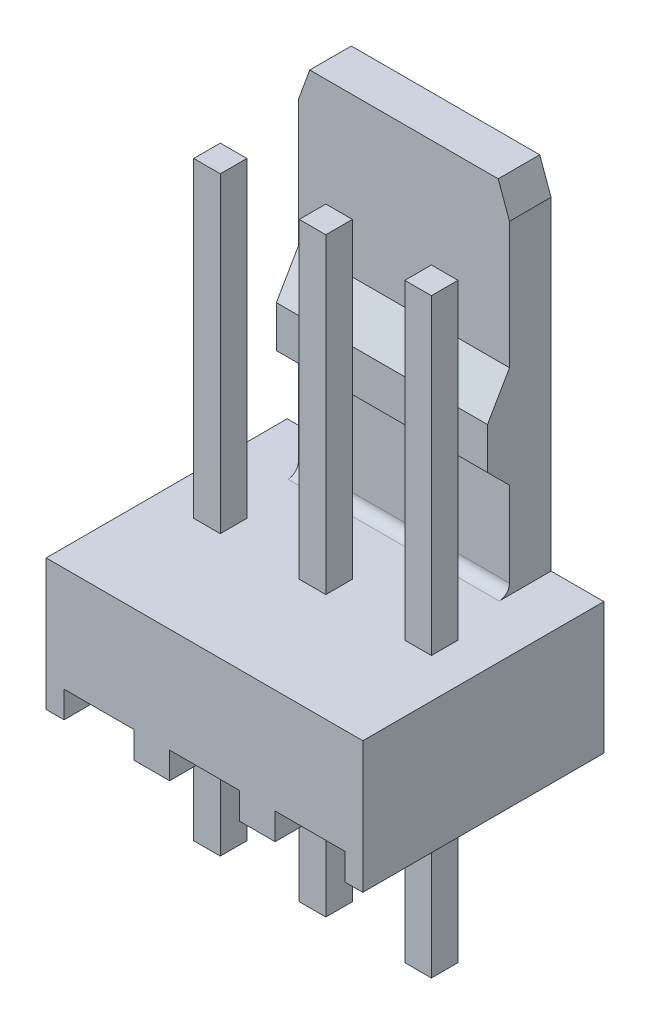
from build123d import *

# Parameters (mm, degrees)
SKETCH1_W           = 7.62
SKETCH1_H           = 5.8
BOSS_EXTRUDE1_DEPTH = 3.16
SKETCH2_W           = 5.08
SKETCH2_H           = 1
BOSS_EXTRUDE2_DEPTH = 8.54
SKETCH3_W           = 5.08
SKETCH3_H           = 6.25
BOSS_EXTRUDE3_DEPTH = 0.53
SKETCH4_W           = 1.68
SKETCH4_H           = 0.64
CUT_EXTRUDE1_DEPTH  = 13.270717175
SKETCH5_W           = 1.68
SKETCH5_H           = 0.64
CUT_EXTRUDE2_DEPTH  = 13.270717175
SKETCH6_W           = 0.53
SKETCH6_H           = 3.802013072
CUT_EXTRUDE3_DEPTH  = 13.298914586
SKETCH7_W           = 1.68
SKETCH7_H           = 0.64
CUT_EXTRUDE4_DEPTH  = 13.270717175
SKETCH8_W           = 0.64
SKETCH8_H           = 0.64
BOSS_EXTRUDE4_DEPTH = 4.2
SKETCH9_W           = 0.64
SKETCH9_H           = 0.64
BOSS_EXTRUDE5_DEPTH = 4.2
SKETCH10_W          = 0.64
SKETCH10_H          = 0.635
BOSS_EXTRUDE6_DEPTH = 4.2
SKETCH11_W          = 0.64
SKETCH11_H          = 0.64
BOSS_EXTRUDE7_DEPTH = 7.5
SKETCH12_W          = 0.64
SKETCH12_H          = 0.64
BOSS_EXTRUDE8_DEPTH = 7.5
SKETCH13_W          = 0.64
SKETCH13_H          = 0.64
BOSS_EXTRUDE9_DEPTH = 7.5
DRAFT1_ANGLE        = 45
DRAFT2_ANGLE        = 60
CHAMFER1_SIZE       = 0.75
CHAMFER1_SIZE2      = 0.272977676
CHAMFER2_SIZE       = 0.272977676
CHAMFER2_SIZE2      = 0.75
FILLET1_R           = 0.25


with BuildPart() as part:
    # Sketch1 → Boss-Extrude1 (new body)
    with BuildSketch(Plane.XZ.offset(1.58)):
        with Locations((0, 0.02)):
            Rectangle(SKETCH1_W, SKETCH1_H)
    extrude(amount=-BOSS_EXTRUDE1_DEPTH)

    # Sketch2 → Boss-Extrude2 (add)
    with BuildSketch(Plane(origin=(0, 1.58, 0), x_dir=(-1, 0, 0), z_dir=(0, 1, 0))):
        with Locations((0, -2.38)):
            Rectangle(SKETCH2_W, SKETCH2_H)
    extrude(amount=BOSS_EXTRUDE2_DEPTH)

    # Sketch3 → Boss-Extrude3 (add)
    with BuildSketch(Plane.XY.offset(-1.88)):
        with Locations((0, 6.995)):
            Rectangle(SKETCH3_W, SKETCH3_H)
    extrude(amount=BOSS_EXTRUDE3_DEPTH)

    # Sketch4 → Cut-Extrude1 (cut, through all)
    with BuildSketch(Plane(origin=(0, 0, -2.88), x_dir=(-1, 0, 0), z_dir=(0, 0, -1))):
        with Locations((2.54, -1.26)):
            Rectangle(SKETCH4_W, SKETCH4_H)
    extrude(amount=-CUT_EXTRUDE1_DEPTH, mode=Mode.SUBTRACT)

    # Sketch5 → Cut-Extrude2 (cut, through all)
    with BuildSketch(Plane(origin=(0, 0, -2.88), x_dir=(-1, 0, 0), z_dir=(0, 0, -1))):
        with Locations((0, -1.26)):
            Rectangle(SKETCH5_W, SKETCH5_H)
    extrude(amount=-CUT_EXTRUDE2_DEPTH, mode=Mode.SUBTRACT)

    # Sketch6 → Cut-Extrude3 (cut, through all)
    with BuildSketch(Plane(origin=(2.54, 0, 0), x_dir=(0, 0, -1), z_dir=(1, 0, 0))):
        with Locations((1.615, 8.218993464)):
            Rectangle(SKETCH6_W, SKETCH6_H)
    extrude(amount=-CUT_EXTRUDE3_DEPTH, mode=Mode.SUBTRACT)

    # Sketch7 → Cut-Extrude4 (cut, through all)
    with BuildSketch(Plane(origin=(0, 0, -2.88), x_dir=(-1, 0, 0), z_dir=(0, 0, -1))):
        with Locations((-2.54, -1.26)):
            Rectangle(SKETCH7_W, SKETCH7_H)
    extrude(amount=-CUT_EXTRUDE4_DEPTH, mode=Mode.SUBTRACT)

    # Sketch8 → Boss-Extrude4 (add)
    with BuildSketch(Plane.XZ.offset(0.94)):
        Rectangle(SKETCH8_W, SKETCH8_H)
    extrude(amount=BOSS_EXTRUDE4_DEPTH)

    # Sketch9 → Boss-Extrude5 (add)
    with BuildSketch(Plane.XZ.offset(0.94)):
        with Locations((-2.54, 0)):
            Rectangle(SKETCH9_W, SKETCH9_H)
    extrude(amount=BOSS_EXTRUDE5_DEPTH)

    # Sketch10 → Boss-Extrude6 (add)
    with BuildSketch(Plane.XZ.offset(0.94)):
        with Locations((2.54, 0.0025)):
            Rectangle(SKETCH10_W, SKETCH10_H)
    extrude(amount=BOSS_EXTRUDE6_DEPTH)

    # Sketch11 → Boss-Extrude7 (add)
    with BuildSketch(Plane(origin=(0, 1.58, 0), x_dir=(-1, 0, 0), z_dir=(0, 1, 0))):
        Rectangle(SKETCH11_W, SKETCH11_H)
    extrude(amount=BOSS_EXTRUDE7_DEPTH)

    # Sketch12 → Boss-Extrude8 (add)
    with BuildSketch(Plane(origin=(0, 1.58, 0), x_dir=(-1, 0, 0), z_dir=(0, 1, 0))):
        with Locations((-2.54, 0)):
            Rectangle(SKETCH12_W, SKETCH12_H)
    extrude(amount=BOSS_EXTRUDE8_DEPTH)

    # Sketch13 → Boss-Extrude9 (add)
    with BuildSketch(Plane(origin=(0, 1.58, 0), x_dir=(-1, 0, 0), z_dir=(0, 1, 0))):
        with Locations((2.54, 0)):
            Rectangle(SKETCH13_W, SKETCH13_H)
    extrude(amount=BOSS_EXTRUDE9_DEPTH)

    # Draft1
    draft1_faces = [part.faces().sort_by_distance(p)[0] for p in [
        (0, 3.87, -1.615),
    ]]
    draft(draft1_faces, Plane(origin=(2.54, 10.12, -1.88), x_dir=(1, 0, 0), z_dir=(0, 0, 1)), DRAFT1_ANGLE)

    # Draft2
    draft2_faces = [part.faces().sort_by_distance(p)[0] for p in [
        (0, 6.317986928, -1.615),
    ]]
    draft(draft2_faces, Plane(origin=(-3.810025, 6.317986928, -1.88), x_dir=(1, 0, 0), z_dir=(0, 0, 1)), DRAFT2_ANGLE)

    # Chamfer1
    chamfer1_edges = [part.edges().sort_by_distance(p)[0] for p in [
        (2.54, 10.12, -2.38),
    ]]
    chamfer1_side = [part.faces().sort_by_distance(p)[0] for p in [
        (2.54, 5.768868228, -2.309646908),
    ]]
    chamfer(chamfer1_edges, length=CHAMFER1_SIZE, length2=CHAMFER1_SIZE2, reference=chamfer1_side[0])

    # Chamfer2
    chamfer2_edges = [part.edges().sort_by_distance(p)[0] for p in [
        (-2.54, 10.12, -2.38),
    ]]
    chamfer2_side = [part.faces().sort_by_distance(p)[0] for p in [
        (-0.136488838, 10.12, -2.38),
    ]]
    chamfer(chamfer2_edges, length=CHAMFER2_SIZE, length2=CHAMFER2_SIZE2, reference=chamfer2_side[0])

    # Fillet1
    fillet1_edges = [part.edges().sort_by_distance(p)[0] for p in [
        (0, 1.58, -1.88),
    ]]
    fillet(fillet1_edges, radius=FILLET1_R)


solid = part.part
